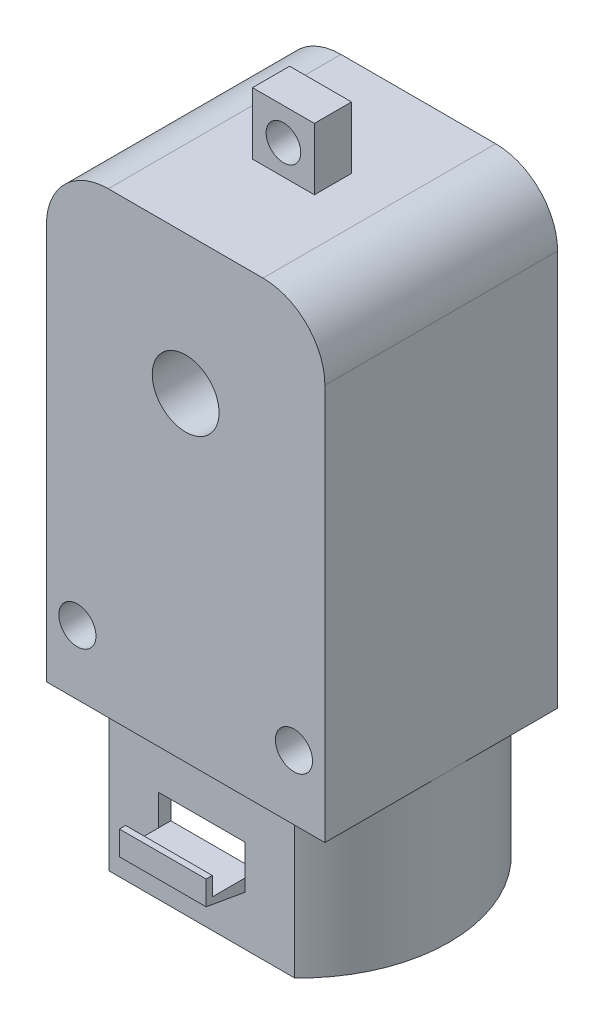
from build123d import *

# Parameters (mm, degrees)
CROQUIS2_R              = 1.5
SALIENTE_EXTRUIR1_DEPTH = 9.4
CROQUIS3_W              = 5
CROQUIS3_H              = 5
CROQUIS3_R              = 1.4
SALIENTE_EXTRUIR2_DEPTH = 1.5
SALIENTE_EXTRUIR3_DEPTH = 12
CROQUIS6_W              = 7
CROQUIS6_H              = 2.5
CORTAR_EXTRUIR1_DEPTH   = 57.687741179
SALIENTE_EXTRUIR4_START = 7.75
SALIENTE_EXTRUIR4_DEPTH = 7
CROQUIS8_R              = 2.7
CORTAR_EXTRUIR2_DEPTH   = 58.737964114


with BuildPart() as part:
    # Croquis2 → Saliente-Extruir1 (new, symmetric)
    with BuildSketch(Plane.XY):
        with BuildLine():
            Line((5, 0), (17.5, 0))
            ThreePointArc((17.5, 0), (21.035533906, -1.464466094), (22.5, -5))
            Line((22.5, -5), (22.5, -37))
            Line((22.5, -37), (0, -37))
            Line((0, -37), (0, -5))
            ThreePointArc((0, -5), (1.464466094, -1.464466094), (5, 0))
        make_face()
        with Locations((2.5, -31.8)):
            Circle(CROQUIS2_R, mode=Mode.SUBTRACT)
        with Locations((20, -31.8)):
            Circle(CROQUIS2_R, mode=Mode.SUBTRACT)
    extrude(amount=SALIENTE_EXTRUIR1_DEPTH, both=True)

    # Croquis3 → Saliente-Extruir2 (add, symmetric)
    with BuildSketch(Plane.XY):
        with Locations((11.25, 2.5)):
            Rectangle(CROQUIS3_W, CROQUIS3_H)
        with Locations((11.25, 2.4)):
            Circle(CROQUIS3_R, mode=Mode.SUBTRACT)
    extrude(amount=SALIENTE_EXTRUIR2_DEPTH, both=True)

    # Croquis5 → Saliente-Extruir3 (add)
    with BuildSketch(Plane.XZ.offset(37)):
        with BuildLine():
            Line((18.75, -9.4), (3.75, -9.4))
            ThreePointArc((3.75, -9.4), (0, -0.65), (3.75, 8.1))
            Line((3.75, 8.1), (18.75, 8.1))
            ThreePointArc((18.75, 8.1), (22.5, -0.65), (18.75, -9.4))
        make_face()
        with BuildLine():
            Line((4.160090451, 7.1), (18.339909549, 7.1))
            ThreePointArc((18.339909549, 7.1), (21.5, -0.65), (18.339909549, -8.4))
            Line((18.339909549, -8.4), (4.160090451, -8.4))
            ThreePointArc((4.160090451, -8.4), (1, -0.65), (4.160090451, 7.1))
        make_face(mode=Mode.SUBTRACT)
    extrude(amount=SALIENTE_EXTRUIR3_DEPTH)

    # Croquis6 → Cortar-Extruir1 (cut, through all)
    with BuildSketch(Plane.XY.offset(8.1)):
        with Locations((11.25, -42.75)):
            Rectangle(CROQUIS6_W, CROQUIS6_H)
    extrude(amount=-CORTAR_EXTRUIR1_DEPTH, mode=Mode.SUBTRACT)

    # Croquis7 → Saliente-Extruir4 (add)
    with BuildSketch(Plane(origin=(0, 0, 0), x_dir=(0, 0, -1), z_dir=(1, 0, 0)).offset(SALIENTE_EXTRUIR4_START)):
        Polygon((-8.1, -44), (-10.75, -44), (-10.75, -42.5), (-11.25, -42.5), (-11.25, -44.444570011), (-8.1, -45), align=None)
    saliente_extruir4 = extrude(amount=SALIENTE_EXTRUIR4_DEPTH)

    # Simetría1: Saliente-Extruir4 across plane
    add(saliente_extruir4.mirror(Plane(origin=(0, 0, -0.65), x_dir=(1, 0, 0), z_dir=(0, 0, -1))))

    # Croquis8 → Cortar-Extruir2 (cut, through all)
    with BuildSketch(Plane(origin=(0, 0, -9.4), x_dir=(-1, 0, 0), z_dir=(0, 0, -1))):
        with Locations((-11.25, -11.2)):
            Circle(CROQUIS8_R)
    extrude(amount=-CORTAR_EXTRUIR2_DEPTH, mode=Mode.SUBTRACT)


solid = part.part
